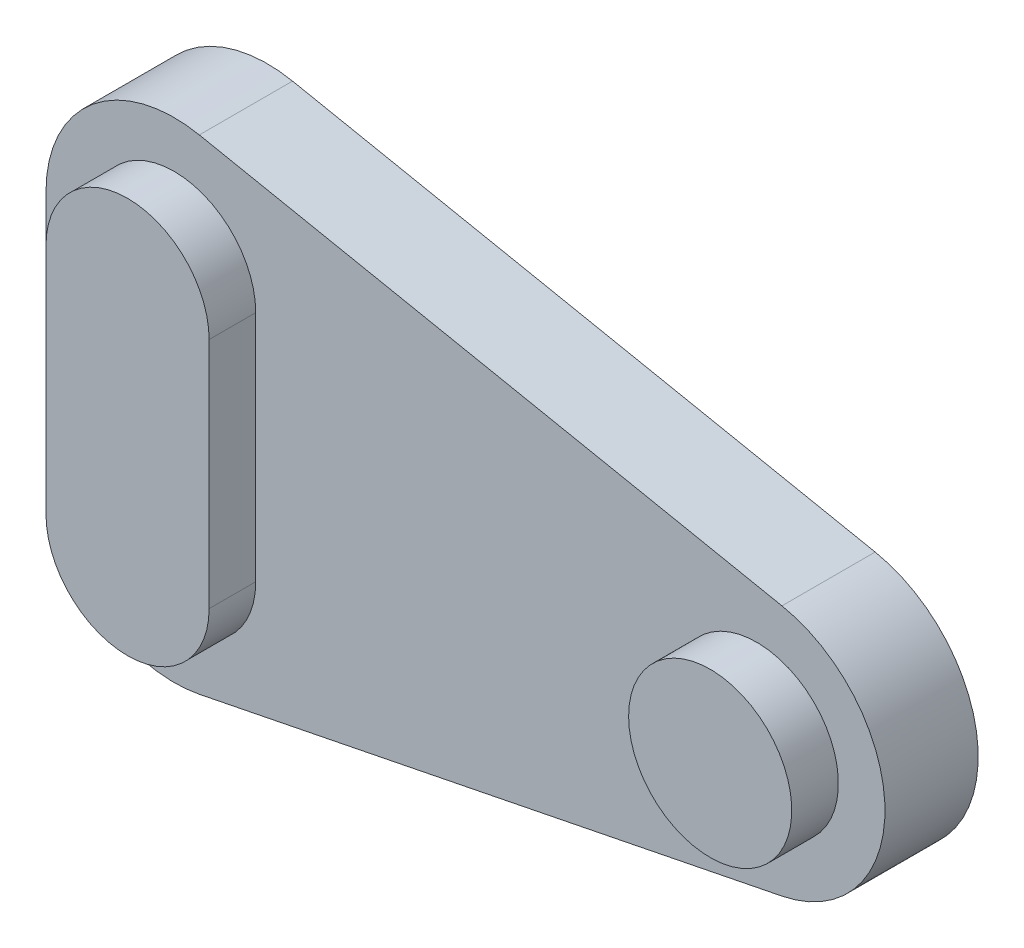
from build123d import *

# Parameters (mm, degrees)
SKETCH1_R           = 4.445
BOSS_EXTRUDE1_DEPTH = 5.08
SKETCH1_8_R         = 4.445
BOSS_EXTRUDE2_DEPTH = 7.62


with BuildPart() as part:
    # Sketch1 → Boss-Extrude1 (new body)
    with BuildSketch(Plane.XY):
        with BuildLine():
            Line((-6.985, 0), (-6.985001912, 12.7))
            ThreePointArc((-6.985001912, 12.7), (-4.428413558, 18.101796467), (1.369871983, 19.549357814))
            Line((1.369871983, 19.549357814), (33.119871608, 13.199355939))
            ThreePointArc((33.119871608, 13.199355939), (38.735, 6.349999683), (33.119870986, -0.499356063))
            Line((33.119870986, -0.499356063), (1.369870986, -6.849355012))
            ThreePointArc((1.369870986, -6.849355012), (-4.428412185, -5.401794068), (-6.985, 0))
        make_face()
        with Locations((31.75, 6.35)):
            Circle(SKETCH1_R, mode=Mode.SUBTRACT)
        with BuildLine():
            Line((-4.445, 0), (-4.445, 12.7))
            ThreePointArc((-4.445, 12.7), (0, 17.145), (4.445, 12.7))
            Line((4.445, 12.7), (4.445, 0))
            ThreePointArc((4.445, 0), (0, -4.445), (-4.445, 0))
        make_face(mode=Mode.SUBTRACT)
    extrude(amount=BOSS_EXTRUDE1_DEPTH)

    # Sketch1<8> → Boss-Extrude2 (add)
    with BuildSketch(Plane.XY):
        with BuildLine():
            Line((-4.445, 12.7), (-4.445, 0))
            ThreePointArc((-4.445, 0), (0, -4.445), (4.445, 0))
            Line((4.445, 0), (4.445, 12.7))
            ThreePointArc((4.445, 12.7), (0, 17.145), (-4.445, 12.7))
        make_face()
        with Locations((31.75, 6.35)):
            Circle(SKETCH1_8_R)
    extrude(amount=BOSS_EXTRUDE2_DEPTH)


solid = part.part
